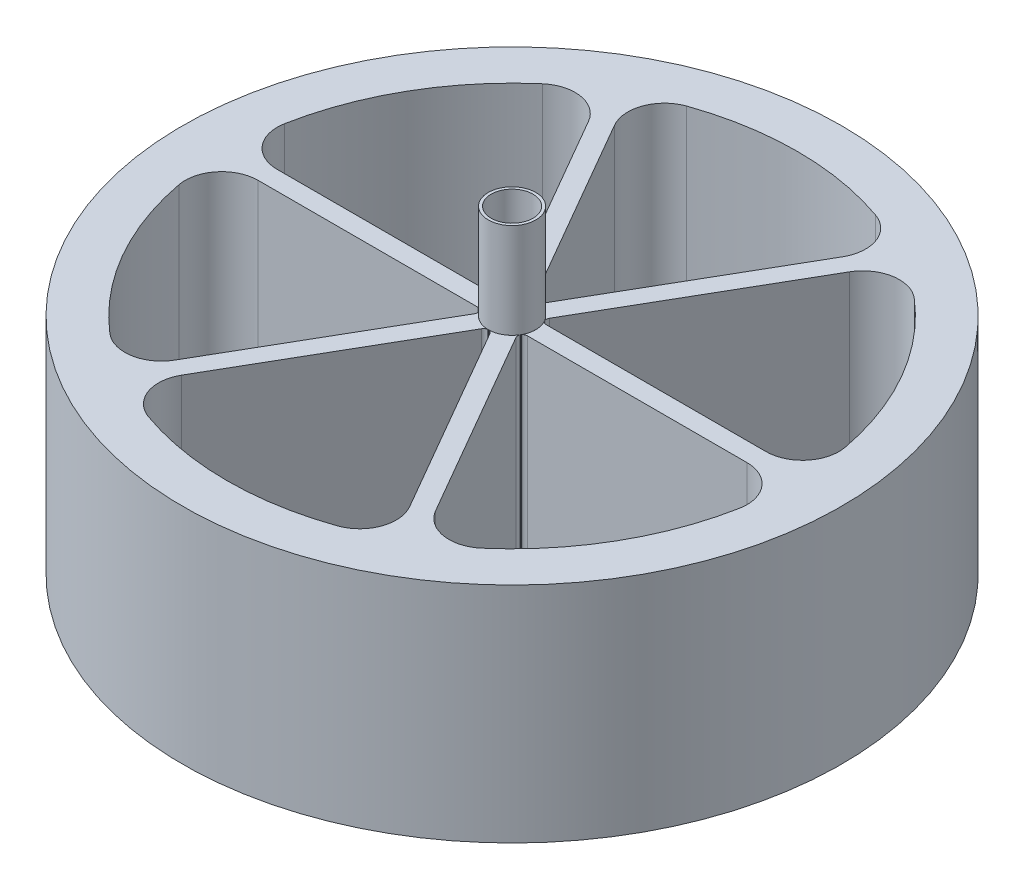
from build123d import *

# Parameters (mm, degrees)
SKETCH1_R             = 2.5
SKETCH1_R_2           = 2.2
BOSS_EXTRUDE1_DEPTH   = 10
BOSS_EXTRUDE3_DEPTH   = 23.5
BOSS_EXTRUDE3_2_DEPTH = 23.5
BOSS_EXTRUDE3_3_DEPTH = 23.5
BOSS_EXTRUDE3_4_DEPTH = 23.5
BOSS_EXTRUDE3_5_DEPTH = 23.5
BOSS_EXTRUDE3_6_DEPTH = 23.5
SKETCH5_R             = 34.666608733
SKETCH5_R_2           = 30
BOSS_EXTRUDE4_DEPTH   = 23.5
SKETCH6_R             = 1.5
BOSS_EXTRUDE5_DEPTH   = 10
SKETCH8_R             = 1.5
CUT_EXTRUDE2_DEPTH    = 10


with BuildPart() as part:
    # Sketch1 → Boss-Extrude1 (new body)
    with BuildSketch(Plane(origin=(0, 0, 0), x_dir=(1, 0, 0), z_dir=(0, 1, 0))):
        with Locations(Location((0, 0, 0), (0, 0, 270))):
            Circle(SKETCH1_R)
        with Locations(Location((0, 0, 0), (0, 0, 270))):
            Circle(SKETCH1_R_2, mode=Mode.SUBTRACT)
    extrude(amount=BOSS_EXTRUDE1_DEPTH)


with BuildPart() as body_2:
    # Sketch2 → Boss-Extrude3 (new body)
    with BuildSketch(Plane(origin=(0, 0, 0), x_dir=(-1, 0, 0), z_dir=(0, -1, 0))):
        with BuildLine():
            Line((2.61395079, 1), (25.707973339, 1))
            ThreePointArc((25.707973339, 1), (28.664062792, 2.388870469), (29.481986287, 5.550899437))
            ThreePointArc((29.481986287, 5.550899437), (30, 0), (29.481986287, -5.550899437))
            ThreePointArc((29.481986287, -5.550899437), (28.664062792, -2.388870469), (25.707973339, -1))
            Line((25.707973339, -1), (2.61395079, -1))
            ThreePointArc((2.61395079, -1), (2.399550586, -1.045528996), (2.222154945, -1.174257873))
            Line((2.222154945, -1.174257873), (2.178514499, -1.226407182))
            ThreePointArc((2.178514499, -1.226407182), (2.499969191, -0.012411485), (2.190584188, 1.204716114))
            Line((2.190584188, 1.204716114), (2.222154945, 1.174257873))
            ThreePointArc((2.222154945, 1.174257873), (2.399550586, 1.045528996), (2.61395079, 1))
        make_face()
    extrude(amount=BOSS_EXTRUDE3_DEPTH)



with BuildPart() as body_3:
    # Sketch2 → Boss-Extrude3 2 (new body)
    with BuildSketch(Plane(origin=(0, 0, 0), x_dir=(-1, 0, 0), z_dir=(0, -1, 0))):
        with BuildLine():
            Line((0.440949991, -2.763747789), (11.987961266, -22.763757991))
            ThreePointArc((11.987961266, -22.763757991), (12.263208883, -26.018241788), (9.933773217, -28.307598797))
            ThreePointArc((9.933773217, -28.307598797), (15, -25.980762114), (19.54821307, -22.75669936))
            ThreePointArc((19.54821307, -22.75669936), (16.400853909, -23.629371319), (13.720012073, -21.763757991))
            Line((13.720012073, -21.763757991), (2.173000799, -1.763747789))
            ThreePointArc((2.173000799, -1.763747789), (2.105229964, -1.555307267), (2.128014621, -1.337313697))
            Line((2.128014621, -1.337313697), (2.138606853, -1.294743499))
            ThreePointArc((2.138606853, -1.294743499), (1.239235934, -2.17124257), (0.027157474, -2.49985249))
            Line((0.027157474, -2.49985249), (0.094140324, -2.511571571))
            ThreePointArc((0.094140324, -2.511571571), (0.294320622, -2.600836263), (0.440949991, -2.763747789))
        make_face()
    extrude(amount=BOSS_EXTRUDE3_2_DEPTH)


with BuildPart() as body_4:
    # Sketch2 → Boss-Extrude3 3 (new body)
    with BuildSketch(Plane(origin=(0, 0, 0), x_dir=(-1, 0, 0), z_dir=(0, -1, 0))):
        with BuildLine():
            Line((-2.173000799, -1.763747789), (-13.720012073, -21.763757991))
            ThreePointArc((-13.720012073, -21.763757991), (-16.400853909, -23.629371319), (-19.54821307, -22.75669936))
            ThreePointArc((-19.54821307, -22.75669936), (-15, -25.980762114), (-9.933773217, -28.307598797))
            ThreePointArc((-9.933773217, -28.307598797), (-12.263208883, -26.018241788), (-11.987961266, -22.763757991))
            Line((-11.987961266, -22.763757991), (-0.440949991, -2.763747789))
            ThreePointArc((-0.440949991, -2.763747789), (-0.294320622, -2.600836263), (-0.094140324, -2.511571571))
            Line((-0.094140324, -2.511571571), (-0.051977335, -2.499459613))
            ThreePointArc((-0.051977335, -2.499459613), (-1.260733257, -2.158831086), (-2.151357025, -1.273445308))
            Line((-2.151357025, -1.273445308), (-2.128014621, -1.337313697))
            ThreePointArc((-2.128014621, -1.337313697), (-2.105229964, -1.555307267), (-2.173000799, -1.763747789))
        make_face()
    extrude(amount=BOSS_EXTRUDE3_3_DEPTH)


with BuildPart() as body_5:
    # Sketch2 → Boss-Extrude3 4 (new body)
    with BuildSketch(Plane(origin=(0, 0, 0), x_dir=(-1, 0, 0), z_dir=(0, -1, 0))):
        with BuildLine():
            Line((-2.61395079, 1), (-25.707973339, 1))
            ThreePointArc((-25.707973339, 1), (-28.664062792, 2.388870469), (-29.481986287, 5.550899437))
            ThreePointArc((-29.481986287, 5.550899437), (-30, 0), (-29.481986287, -5.550899437))
            ThreePointArc((-29.481986287, -5.550899437), (-28.664062792, -2.388870469), (-25.707973339, -1))
            Line((-25.707973339, -1), (-2.61395079, -1))
            ThreePointArc((-2.61395079, -1), (-2.399550586, -1.045528996), (-2.222154945, -1.174257873))
            Line((-2.222154945, -1.174257873), (-2.190584188, -1.204716114))
            ThreePointArc((-2.190584188, -1.204716114), (-2.499969191, 0.012411485), (-2.178514499, 1.226407182))
            Line((-2.178514499, 1.226407182), (-2.222154945, 1.174257873))
            ThreePointArc((-2.222154945, 1.174257873), (-2.399550586, 1.045528996), (-2.61395079, 1))
        make_face()
    extrude(amount=BOSS_EXTRUDE3_4_DEPTH)


with BuildPart() as body_6:
    # Sketch2 → Boss-Extrude3 5 (new body)
    with BuildSketch(Plane(origin=(0, 0, 0), x_dir=(-1, 0, 0), z_dir=(0, -1, 0))):
        with BuildLine():
            Line((-0.440949991, 2.763747789), (-11.987961266, 22.763757991))
            ThreePointArc((-11.987961266, 22.763757991), (-12.263208883, 26.018241788), (-9.933773217, 28.307598797))
            ThreePointArc((-9.933773217, 28.307598797), (-15, 25.980762114), (-19.54821307, 22.75669936))
            ThreePointArc((-19.54821307, 22.75669936), (-16.400853909, 23.629371319), (-13.720012073, 21.763757991))
            Line((-13.720012073, 21.763757991), (-2.173000799, 1.763747789))
            ThreePointArc((-2.173000799, 1.763747789), (-2.105229964, 1.555307267), (-2.128014621, 1.337313697))
            Line((-2.128014621, 1.337313697), (-2.138606853, 1.294743499))
            ThreePointArc((-2.138606853, 1.294743499), (-1.239235934, 2.17124257), (-0.027157474, 2.49985249))
            Line((-0.027157474, 2.49985249), (-0.094140324, 2.511571571))
            ThreePointArc((-0.094140324, 2.511571571), (-0.294320622, 2.600836263), (-0.440949991, 2.763747789))
        make_face()
    extrude(amount=BOSS_EXTRUDE3_5_DEPTH)


with BuildPart() as body_7:
    # Sketch2 → Boss-Extrude3 6 (new body)
    with BuildSketch(Plane(origin=(0, 0, 0), x_dir=(-1, 0, 0), z_dir=(0, -1, 0))):
        with BuildLine():
            Line((2.173000799, 1.763747789), (13.720012073, 21.763757991))
            ThreePointArc((13.720012073, 21.763757991), (16.400853909, 23.629371319), (19.54821307, 22.75669936))
            ThreePointArc((19.54821307, 22.75669936), (15, 25.980762114), (9.933773217, 28.307598797))
            ThreePointArc((9.933773217, 28.307598797), (12.263208883, 26.018241788), (11.987961266, 22.763757991))
            Line((11.987961266, 22.763757991), (0.440949991, 2.763747789))
            ThreePointArc((0.440949991, 2.763747789), (0.294320622, 2.600836263), (0.094140324, 2.511571571))
            Line((0.094140324, 2.511571571), (0.051977335, 2.499459613))
            ThreePointArc((0.051977335, 2.499459613), (1.260733257, 2.158831086), (2.151357025, 1.273445308))
            Line((2.151357025, 1.273445308), (2.128014621, 1.337313697))
            ThreePointArc((2.128014621, 1.337313697), (2.105229964, 1.555307267), (2.173000799, 1.763747789))
        make_face()
    extrude(amount=BOSS_EXTRUDE3_6_DEPTH)


with BuildPart() as body_2_1:
    add(body_2.part)

    add(body_3.part)  # Boss-Extrude4 merges body 3

    add(body_4.part)  # Boss-Extrude4 merges body 4

    add(body_5.part)  # Boss-Extrude4 merges body 5

    add(body_6.part)  # Boss-Extrude4 merges body 6

    add(body_7.part)  # Boss-Extrude4 merges body 7
    # Sketch5 → Boss-Extrude4 (add)
    with BuildSketch(Plane(origin=(0, -23.5, 0), x_dir=(-1, 0, 0), z_dir=(0, -1, 0))):
        with Locations(Location((0, 0, 0), (0, 0, 90))):
            Circle(SKETCH5_R)
        Circle(SKETCH5_R_2, mode=Mode.SUBTRACT)
    extrude(amount=-BOSS_EXTRUDE4_DEPTH)


with BuildPart() as body_3_2:
    # Sketch6 → Boss-Extrude5 (new body)
    with BuildSketch(Plane(origin=(0, 10, 0), x_dir=(1, 0, 0), z_dir=(0, 1, 0))):
        with Locations(Location((0, 0, 0), (0, 0, 270))):
            Circle(SKETCH6_R)
    extrude(amount=-BOSS_EXTRUDE5_DEPTH)

    # Sketch8 → Cut-Extrude2 (cut)
    with BuildSketch(Plane(origin=(0, 10, 0), x_dir=(1, 0, 0), z_dir=(0, 1, 0))):
        Circle(SKETCH8_R)
    extrude(amount=-CUT_EXTRUDE2_DEPTH, mode=Mode.SUBTRACT)


solid = Compound([part.part, body_2_1.part])
